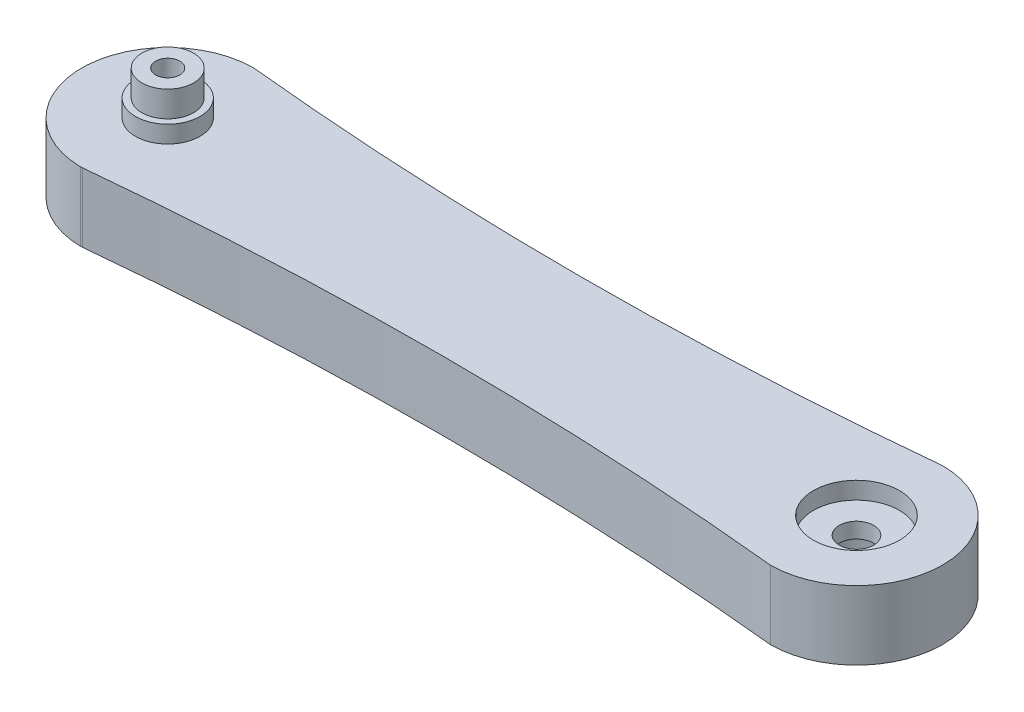
from build123d import *

# Parameters (mm, degrees)
SKETCH1_R           = 1.4
SKETCH1_R_2         = 2
BOSS_EXTRUDE1_DEPTH = 8
SKETCH2_R           = 3.75
BOSS_EXTRUDE2_DEPTH = 2
SKETCH3_R           = 3
BOSS_EXTRUDE3_DEPTH = 3
SKETCH4_R           = 1.4
CUT_EXTRUDE1_DEPTH  = 53.621288468
SKETCH5_R           = 5
CUT_EXTRUDE2_DEPTH  = 6
SKETCH6_R           = 5.25
CUT_EXTRUDE3_DEPTH  = 3.2
SKETCH7_R           = 5
CUT_EXTRUDE4_DEPTH  = 2
SKETCH8_R           = 4
CUT_EXTRUDE5_DEPTH  = 1
CUT_EXTRUDE6_DEPTH  = 52.613951602
FILLET1_R           = 2


with BuildPart() as part:
    # Sketch1 → Boss-Extrude1 (new body)
    with BuildSketch(Plane(origin=(0, 0, 0), x_dir=(1, 0, 0), z_dir=(0, 1, 0))):
        with BuildLine():
            Line((-40, -10), (40, -10))
            ThreePointArc((40, -10), (50, 0), (40, 10))
            Line((40, 10), (-40, 10))
            ThreePointArc((-40, 10), (-50, 0), (-40, -10))
        make_face()
        with Locations(Location((-40, 0, 0), (0, 0, 270))):
            Circle(SKETCH1_R, mode=Mode.SUBTRACT)
        with Locations(Location((40, 0, 0), (0, 0, 270))):
            Circle(SKETCH1_R_2, mode=Mode.SUBTRACT)
    extrude(amount=BOSS_EXTRUDE1_DEPTH)

    # Sketch2 → Boss-Extrude2 (add)
    with BuildSketch(Plane(origin=(0, 8, 0), x_dir=(1, 0, 0), z_dir=(0, 1, 0))):
        with Locations(Location((-40, 0, 0), (0, 0, 90))):
            Circle(SKETCH2_R)
    extrude(amount=BOSS_EXTRUDE2_DEPTH)

    # Sketch3 → Boss-Extrude3 (add)
    with BuildSketch(Plane(origin=(0, 10, 0), x_dir=(1, 0, 0), z_dir=(0, 1, 0))):
        with Locations(Location((-40, 0, 0), (0, 0, 270))):
            Circle(SKETCH3_R)
    extrude(amount=BOSS_EXTRUDE3_DEPTH)

    # Sketch4 → Cut-Extrude1 (cut, through all)
    with BuildSketch(Plane.XZ):
        with Locations(Location((-40, 0, 0), (0, 0, 270))):
            Circle(SKETCH4_R)
    extrude(amount=-CUT_EXTRUDE1_DEPTH, mode=Mode.SUBTRACT)

    # Sketch5 → Cut-Extrude2 (cut)
    with BuildSketch(Plane.XZ):
        with Locations(Location((-40, 0, 0), (0, 0, 270))):
            Circle(SKETCH5_R)
    extrude(amount=-CUT_EXTRUDE2_DEPTH, mode=Mode.SUBTRACT)

    # Sketch6 → Cut-Extrude3 (cut)
    with BuildSketch(Plane.XZ):
        with Locations(Location((40, 0, 0), (0, 0, 270))):
            Circle(SKETCH6_R)
    extrude(amount=-CUT_EXTRUDE3_DEPTH, mode=Mode.SUBTRACT)

    # Sketch7 → Cut-Extrude4 (cut)
    with BuildSketch(Plane(origin=(0, 8, 0), x_dir=(1, 0, 0), z_dir=(0, 1, 0))):
        with Locations(Location((40, 0, 0), (0, 0, 270))):
            Circle(SKETCH7_R)
    extrude(amount=-CUT_EXTRUDE4_DEPTH, mode=Mode.SUBTRACT)

    # Sketch8 → Cut-Extrude5 (cut)
    with BuildSketch(Plane.XZ.offset(-3.2)):
        with Locations(Location((40, 0, 0), (0, 0, 270))):
            Circle(SKETCH8_R)
    extrude(amount=-CUT_EXTRUDE5_DEPTH, mode=Mode.SUBTRACT)

    # Sketch9 → Cut-Extrude6 (cut, symmetric)
    with BuildSketch(Plane(origin=(0, 8, 0), x_dir=(1, 0, 0), z_dir=(0, 1, 0))):
        with BuildLine():
            Line((-40, 10), (40, 10))
            ThreePointArc((40, 10), (0, 7.994974843), (-40, 10))
        make_face()
    cut_extrude6 = extrude(amount=CUT_EXTRUDE6_DEPTH, both=True, mode=Mode.SUBTRACT)

    # Mirror1: Cut-Extrude6 across plane
    add(cut_extrude6.mirror(Plane.XY), mode=Mode.SUBTRACT)

    # Fillet1
    fillet1_edges = [part.edges().sort_by_distance(p)[0] for p in [
        (-40, 4, 10),
        (-40, 4, -10),
    ]]
    fillet(fillet1_edges, radius=FILLET1_R)


solid = part.part
